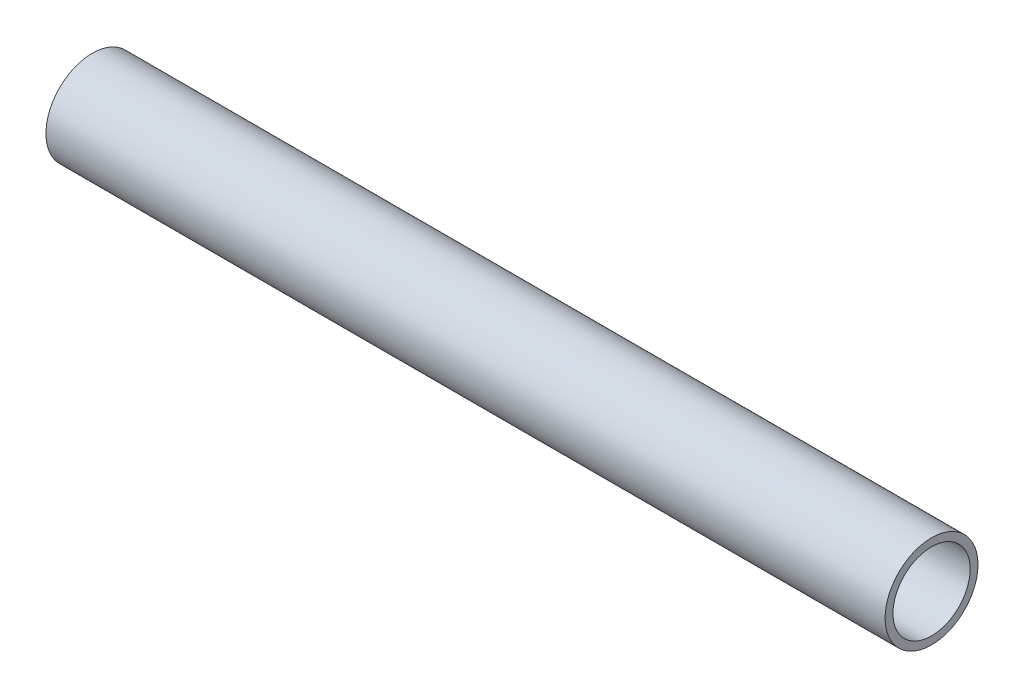
from build123d import *

# Parameters (mm, degrees)
SKETCH1_R           = 21.082
SKETCH1_R_2         = 17.526
BOSS_EXTRUDE1_DEPTH = 190.5


with BuildPart() as part:
    # Sketch1 → Boss-Extrude1 (new, symmetric)
    with BuildSketch(Plane(origin=(0, 0, 0), x_dir=(0, 0, -1), z_dir=(1, 0, 0))):
        Circle(SKETCH1_R)
        Circle(SKETCH1_R_2, mode=Mode.SUBTRACT)
    extrude(amount=BOSS_EXTRUDE1_DEPTH, both=True)


solid = part.part
